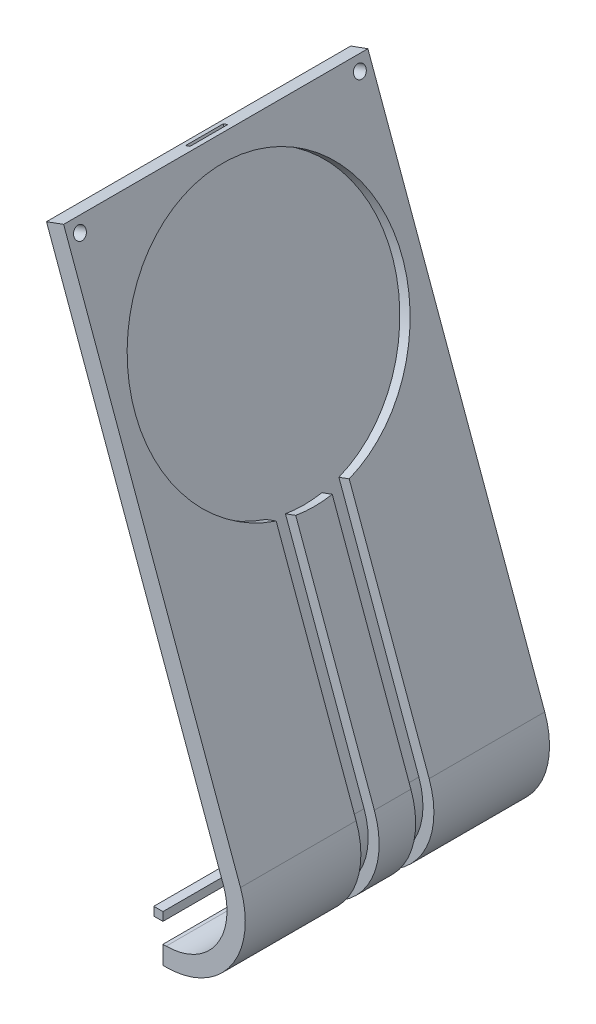
from build123d import *

# Parameters (mm, degrees)
EXTRUDE_1_DEPTH        = 25
SKETCH_4_R             = 22
CUT_EXTRUDE_1_DEPTH    = 1.8
CUT_EXTRUDE_START      = 6
CUT_EXTRUDE_1_2_DEPTH  = 3
SKETCH_11_W            = 18.9
SKETCH_11_H            = 1.710874804
EXTRUDE_3_DEPTH        = 1.5
SKETCH_11_H_2          = 1.4
EXTRUDE_3_2_DEPTH      = 1.5
FILLET_1_R             = 0.25
SKETCH_12_R            = 1
CUT_EXTRUDE_2529_DEPTH = 93.908684176
SKETCH_14_W            = 0.8
SKETCH_14_H            = 6.2
CUT_EXTRUDE_2_DEPTH    = 1


with BuildPart() as part:
    # 草图2 → 整体拉伸-薄壁1 (new, symmetric)
    with BuildSketch(Plane.XY):
        with BuildLine():
            Line((30.469246085, 5.049687275), (31.002548264, 5.049687275))
            ThreePointArc((31.002548264, 5.049687275), (39.194068707, 9.313922912), (40.399474472, 18.469888708))
            Line((40.399474472, 18.469888708), (11.335108905, 98.323576814))
            Line((11.335108905, 98.323576814), (14.154186767, 99.349637244))
            Line((14.154186767, 99.349637244), (43.218552334, 19.495949138))
            ThreePointArc((43.218552334, 19.495949138), (41.65152484, 7.593193603), (31.002548264, 2.049687275))
            Line((31.002548264, 2.049687275), (30.469246085, 2.049687275))
            Line((30.469246085, 2.049687275), (30.469246085, 5.049687275))
        make_face()
    extrude(amount=EXTRUDE_1_DEPTH, both=True)

    # 草图4 → Cut-Extrude 1 (cut)
    with BuildSketch(Plane(origin=(44.428819368, 16.170767793, 0), x_dir=(0, 0, -1), z_dir=(0.9396926207859071, 0.3420201433256726, 0))):
        with Locations(Location((0, 63.117104009, 0), (0, 0, 90))):
            Circle(SKETCH_4_R)
    extrude(amount=-CUT_EXTRUDE_1_DEPTH, mode=Mode.SUBTRACT)

    # 草图3 → Cut-Extrude 1 2 (cut)
    with BuildSketch(Plane.XY.offset(CUT_EXTRUDE_START)):
        with BuildLine():
            ThreePointArc((30.469246085, 3.86239141), (40.021460965, 8.408963392), (41.527105617, 18.88031288))
            Line((41.527105617, 18.88031288), (28.674494844, 54.192570761))
            Line((28.674494844, 54.192570761), (27.648434414, 57.011648623))
            Line((27.648434414, 57.011648623), (29.339881131, 57.627284881))
            Line((29.339881131, 57.627284881), (30.365941561, 54.808207019))
            Line((30.365941561, 54.808207019), (43.218552334, 19.495949138))
            ThreePointArc((43.218552334, 19.495949138), (41.470929078, 7.341704197), (30.383536806, 2.064433145))
            Line((30.383536806, 2.064433145), (30.469246085, 3.86239141))
        make_face()
    cut_extrude_1_2 = extrude(amount=-CUT_EXTRUDE_1_2_DEPTH, mode=Mode.SUBTRACT)

    # 镜向1: Cut-Extrude 1 2 across plane
    add(cut_extrude_1_2.mirror(Plane.XY), mode=Mode.SUBTRACT)

    # 草图12 → Cut-Extrude 2529 (cut, through all)
    with BuildSketch(Plane(origin=(41.609741505, 15.144707363, 0), x_dir=(0, 0, 1), z_dir=(-0.9396926207859071, -0.3420201433256726, 0))):
        with Locations(Location((23, 86.517104009, 0), (0, 0, 270))):
            Circle(SKETCH_12_R)
        with Locations(Location((-23, 86.517104009, 0), (0, 0, 270))):
            Circle(SKETCH_12_R)
    extrude(amount=-CUT_EXTRUDE_2529_DEPTH, mode=Mode.SUBTRACT)

    # 草图14 → 切除-拉伸2 (cut)
    with BuildSketch(Plane(origin=(-30.2746326, 83.178869451, 0), x_dir=(0.9396926207859067, 0.3420201433256736, 0), z_dir=(-0.3420201433256736, 0.9396926207859068, 0))):
        with Locations((45.680162028, 0)):
            Rectangle(SKETCH_14_W, SKETCH_14_H)
    extrude(amount=-CUT_EXTRUDE_2_DEPTH, mode=Mode.SUBTRACT)


with BuildPart() as body_2:
    # 草图11 → 底部卡扣凸台-拉伸3 (new body)
    with BuildSketch(Plane.ZY.offset(-30.469246085)):
        with Locations((-15.55, 8.847876505)):
            Rectangle(SKETCH_11_W, SKETCH_11_H)
    extrude(amount=EXTRUDE_3_DEPTH)

    # 底部卡扣圆角1
    fillet_1_edges = [body_2.edges().sort_by_distance(p)[0] for p in [
        (28.969246085, 8.847876505, -6.1),
        (28.969246085, 9.703313907, -15.55),
        (28.969246085, 8.847876505, -25),
        (28.969246085, 7.992439103, -15.55),
    ]]
    fillet(fillet_1_edges, radius=FILLET_1_R)


with BuildPart() as body_3:
    # 草图11 → Extrude 3 2 (new body)
    with BuildSketch(Plane.ZY.offset(-30.469246085)):
        with Locations((15.55, 9.003313907)):
            Rectangle(SKETCH_11_W, SKETCH_11_H_2)
    extrude(amount=EXTRUDE_3_2_DEPTH)


solid = Compound([part.part, body_2.part, body_3.part])
